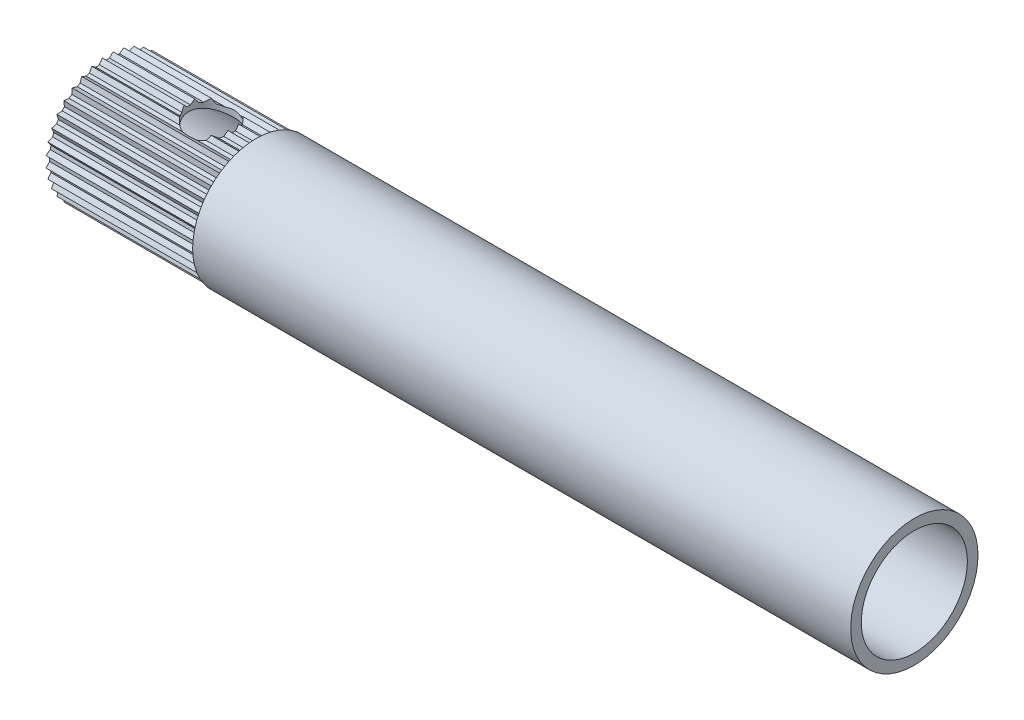
from build123d import *

# Parameters (mm, degrees)
SKETCH1_W               = 120.675
SKETCH1_H               = 1.5875
CUT_EXTRUDE1_DEPTH      = 141.571892194
CUT_EXTRUDE1_DEPTH_BACK = 141.571892194
SKETCH3_R               = 3.3782
CUT_EXTRUDE2_START      = 19.25
SKETCH4_R               = 12.7
CUT_EXTRUDE2_DEPTH      = 22.225


with BuildPart() as part:
    # Sketch1 → Revolve1 (revolve)
    with BuildSketch(Plane(origin=(0, 0, 0), x_dir=(1, 0, 0), z_dir=(0, 1, 0))):
        with Locations((79.5875, 8.73125)):
            Rectangle(SKETCH1_W, SKETCH1_H)
    revolve(axis=Axis((157.324, 0, 0), (-1, 0, 0)))

    # Sketch3 → Cut-Extrude1 (cut, two sides: drawn at the far end of the back side and taken through both)
    with BuildSketch(Plane(origin=(0, 0, 0), x_dir=(1, 0, 0), z_dir=(0, 1, 0)).offset(-CUT_EXTRUDE1_DEPTH_BACK)):
        with Locations(Location((34.7436, 0, 0), (0, 0, 270))):
            Circle(SKETCH3_R)
    extrude(amount=CUT_EXTRUDE1_DEPTH + CUT_EXTRUDE1_DEPTH_BACK, mode=Mode.SUBTRACT)

    # Sketch4 → Cut-Extrude2 (cut)
    with BuildSketch(Plane(origin=(0, 0, 0), x_dir=(0, 0, -1), z_dir=(1, 0, 0)).offset(CUT_EXTRUDE2_START)):
        Circle(SKETCH4_R)
        Polygon((-9.235721046, 0.808020891), (-8.681700155, 0.254), (-8.681700155, -0.254), (-9.235721046, -0.808020891), (-8.593912259, -1.257420242), (-8.505698985, -1.75770258), (-8.955098336, -2.399511367), (-8.245002688, -2.730634406), (-8.071256455, -3.207998257), (-8.402379494, -3.918093905), (-7.645572882, -4.120879625), (-7.391572882, -4.56082053), (-7.594358603, -5.317627141), (-6.813836213, -5.385914002), (-6.487300108, -5.775064579), (-6.555586968, -6.555586968), (-5.775064579, -6.487300108), (-5.385914002, -6.813836213), (-5.317627141, -7.594358603), (-4.56082053, -7.391572882), (-4.120879625, -7.645572882), (-3.918093905, -8.402379494), (-3.207998257, -8.071256455), (-2.730634406, -8.245002688), (-2.399511367, -8.955098336), (-1.75770258, -8.505698985), (-1.257420242, -8.593912259), (-0.808020891, -9.235721046), (-0.254, -8.681700155), (0.254, -8.681700155), (0.808020891, -9.235721046), (1.257420242, -8.593912259), (1.75770258, -8.505698985), (2.399511367, -8.955098336), (2.730634406, -8.245002688), (3.207998257, -8.071256455), (3.918093905, -8.402379494), (4.120879625, -7.645572882), (4.56082053, -7.391572882), (5.317627141, -7.594358603), (5.385914002, -6.813836213), (5.775064579, -6.487300108), (6.555586968, -6.555586968), (6.487300108, -5.775064579), (6.813836213, -5.385914002), (7.594358603, -5.317627141), (7.391572882, -4.56082053), (7.645572882, -4.120879625), (8.402379494, -3.918093905), (8.071256455, -3.207998257), (8.245002688, -2.730634406), (8.955098336, -2.399511367), (8.505698985, -1.75770258), (8.593912259, -1.257420242), (9.235721046, -0.808020891), (8.681700155, -0.254), (8.681700155, 0.254), (9.235721046, 0.808020891), (8.593912259, 1.257420242), (8.505698985, 1.75770258), (8.955098336, 2.399511367), (8.245002688, 2.730634406), (8.071256455, 3.207998257), (8.402379494, 3.918093905), (7.645572882, 4.120879625), (7.391572882, 4.56082053), (7.594358603, 5.317627141), (6.813836213, 5.385914002), (6.487300108, 5.775064579), (6.555586968, 6.555586968), (5.775064579, 6.487300108), (5.385914002, 6.813836213), (5.317627141, 7.594358603), (4.56082053, 7.391572882), (4.120879625, 7.645572882), (3.918093905, 8.402379494), (3.207998257, 8.071256455), (2.730634406, 8.245002688), (2.399511367, 8.955098336), (1.75770258, 8.505698985), (1.257420242, 8.593912259), (0.808020891, 9.235721046), (0.254, 8.681700155), (-0.254, 8.681700155), (-0.808020891, 9.235721046), (-1.257420242, 8.593912259), (-1.75770258, 8.505698985), (-2.399511367, 8.955098336), (-2.730634406, 8.245002688), (-3.207998257, 8.071256455), (-3.918093905, 8.402379494), (-4.120879625, 7.645572882), (-4.56082053, 7.391572882), (-5.317627141, 7.594358603), (-5.385914002, 6.813836213), (-5.775064579, 6.487300108), (-6.555586968, 6.555586968), (-6.487300108, 5.775064579), (-6.813836213, 5.385914002), (-7.594358603, 5.317627141), (-7.391572882, 4.56082053), (-7.645572882, 4.120879625), (-8.402379494, 3.918093905), (-8.071256455, 3.207998257), (-8.245002688, 2.730634406), (-8.955098336, 2.399511367), (-8.505698985, 1.75770258), (-8.593912259, 1.257420242), align=None, mode=Mode.SUBTRACT)
    extrude(amount=CUT_EXTRUDE2_DEPTH, mode=Mode.SUBTRACT)


solid = part.part
